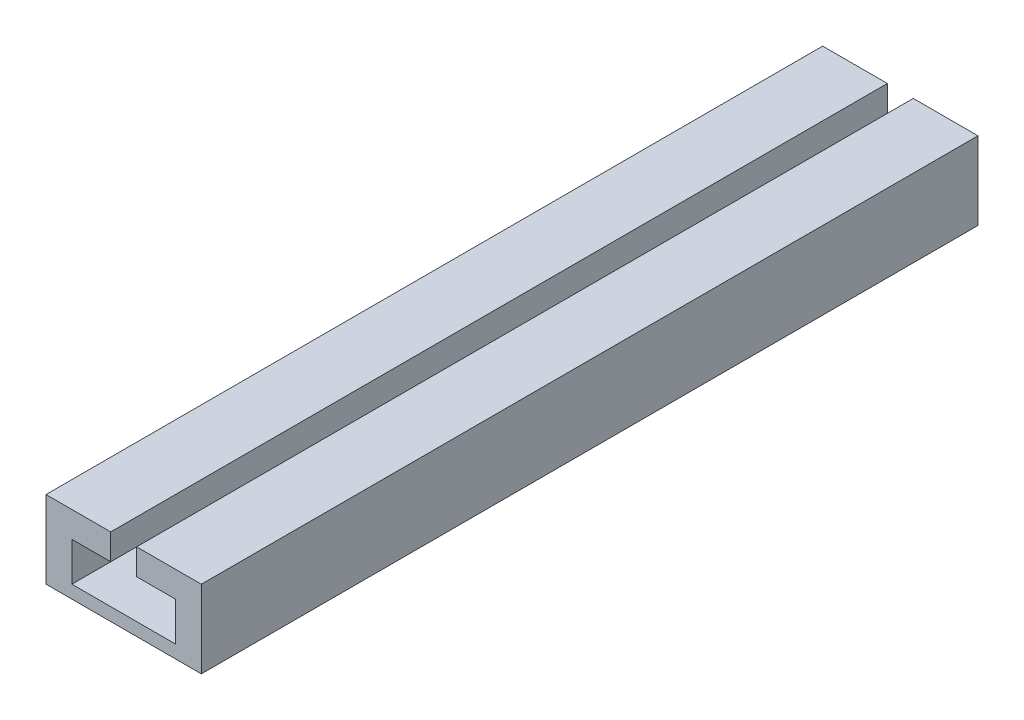
from build123d import *

# Parameters (mm, degrees)
SKETCH_1_W          = 6
SKETCH_1_H          = 3
EXTRUDE_1_DEPTH     = 30
SKETCH_2_W          = 1
SKETCH_2_H          = 1.018441017
CUT_EXTRUDE_2_DEPTH = 30
SKETCH_5_W          = 4
SKETCH_5_H          = 1.5
CUT_EXTRUDE_5_DEPTH = 30


with BuildPart() as part:
    # 草圖1 → 填料-伸長1 (new body)
    with BuildSketch(Plane.XY):
        Rectangle(SKETCH_1_W, SKETCH_1_H)
    extrude(amount=EXTRUDE_1_DEPTH)

    # 草圖2 → 除料-伸長2 (cut)
    with BuildSketch(Plane(origin=(0, 0, 0), x_dir=(-1, 0, 0), z_dir=(0, 0, -1))):
        with Locations((0, 0.990779491)):
            Rectangle(SKETCH_2_W, SKETCH_2_H)
    extrude(amount=-CUT_EXTRUDE_2_DEPTH, mode=Mode.SUBTRACT)

    # 草圖5 → 除料-伸長5 (cut)
    with BuildSketch(Plane(origin=(0, 0, 0), x_dir=(-1, 0, 0), z_dir=(0, 0, -1))):
        with Locations((0, -0.25)):
            Rectangle(SKETCH_5_W, SKETCH_5_H)
    extrude(amount=-CUT_EXTRUDE_5_DEPTH, mode=Mode.SUBTRACT)


solid = part.part
